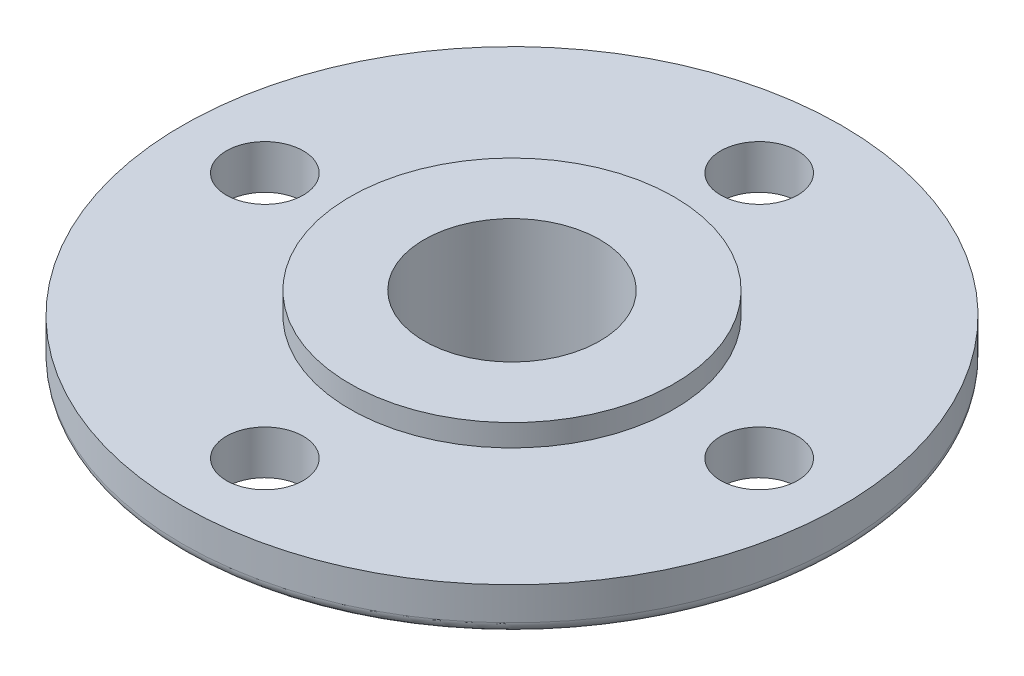
from build123d import *

# Parameters (mm, degrees)
SKETCH_2_R          = 7
CUT_EXTRUDE_1_DEPTH = 89.746830997


with BuildPart() as part:
    # Эскиз1 → Повернуть1 (revolve)
    with BuildSketch(Plane.XY, mode=Mode.PRIVATE) as revolve_1_sk:
        with BuildLine():
            Line((-16, 0), (-16, 30))
            Line((-16, 30), (-29.5, 30))
            Line((-29.5, 30), (-29.5, 26))
            Line((-29.5, 26), (-60, 26))
            Line((-60, 26), (-60, 20))
            ThreePointArc((-60, 20), (-59.414213562, 18.585786438), (-58, 18))
            Line((-58, 18), (-26.480170025, 18))
            ThreePointArc((-26.480170025, 18), (-25.290395707, 17.607618447), (-24.567466883, 16.584437071))
            Line((-24.567466883, 16.584437071), (-19.5, 0))
            Line((-19.5, 0), (-16, 0))
        make_face()
    revolve(revolve_1_sk.sketch.rotate(Axis((0, 0, 0), (0, 1, 0)), 270), axis=Axis((0, 0, 0), (0, 1, 0)))

    # Эскиз2 → Вырез-Вытянуть1 (cut, through all)
    with BuildSketch(Plane(origin=(0, 26, 0), x_dir=(1, 0, 0), z_dir=(0, 1, 0))):
        with Locations(Location((-45, 0, 0), (0, 0, 270))):
            Circle(SKETCH_2_R)
        with Locations(Location((0, 45, 0), (0, 0, 270))):
            Circle(SKETCH_2_R)
        with Locations(Location((45, 0, 0), (0, 0, 270))):
            Circle(SKETCH_2_R)
        with Locations(Location((0, -45, 0), (0, 0, 270))):
            Circle(SKETCH_2_R)
    extrude(amount=-CUT_EXTRUDE_1_DEPTH, mode=Mode.SUBTRACT)


solid = part.part
